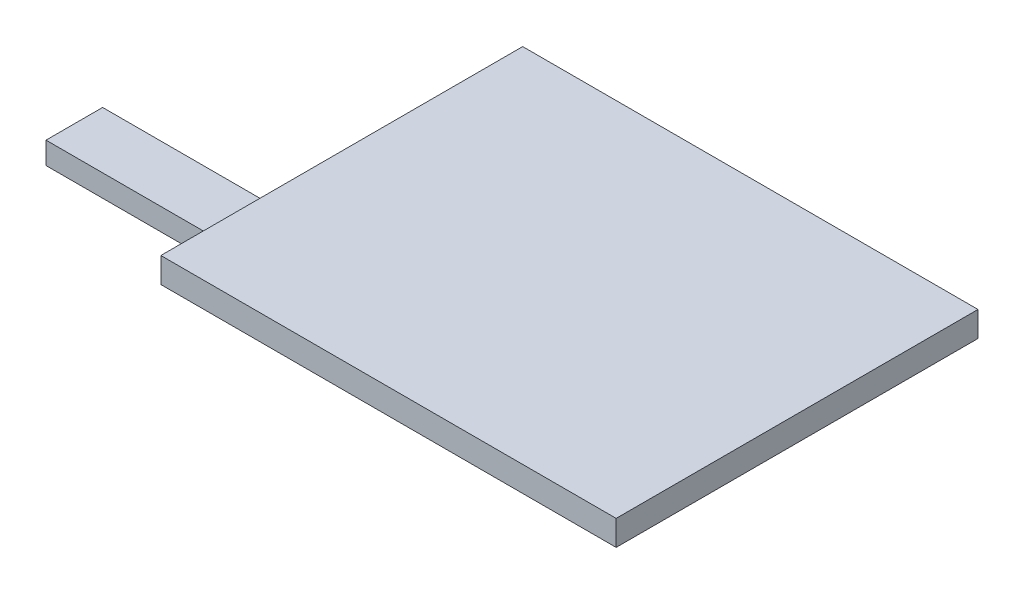
from build123d import *

# Parameters (mm, degrees)
SKETCH1_W           = 144.7
SKETCH1_H           = 8
BOSS_EXTRUDE1_DEPTH = 115
SKETCH3_W           = 10
SKETCH3_H           = 18
BOSS_EXTRUDE2_DEPTH = 14
SKETCH4_W           = 18
SKETCH4_H           = 7
BOSS_EXTRUDE6_DEPTH = 65
BOSS_EXTRUDE7_DEPTH = 10
BOSS_EXTRUDE8_DEPTH = 10


with BuildPart() as part:
    # Sketch1 → Boss-Extrude1 (new body)
    with BuildSketch(Plane.XY):
        with Locations((34.899775573, 7.072761635)):
            Rectangle(SKETCH1_W, SKETCH1_H)
    extrude(amount=BOSS_EXTRUDE1_DEPTH)

    # Sketch3 → Boss-Extrude2 (add)
    with BuildSketch(Plane.XZ.offset(-3.072761635)):
        with Locations((-32.450224427, 77.5)):
            Rectangle(SKETCH3_W, SKETCH3_H)
    extrude(amount=BOSS_EXTRUDE2_DEPTH)

    # Sketch4 → Boss-Extrude6 (add)
    with BuildSketch(Plane.ZY.offset(37.450224427)):
        with Locations((77.5, -7.427238365)):
            Rectangle(SKETCH4_W, SKETCH4_H)
    extrude(amount=BOSS_EXTRUDE6_DEPTH)

    # Sketch5 → Boss-Extrude7 (add)
    with BuildSketch(Plane.XY.offset(86.5)):
        Polygon((-37.450224427, 3.072761635), (-27.450224427, 3.072761635), (-27.450224427, -3.927238365), (-27.450224427, -10.927238365), (-37.450224427, -10.927238365), (-37.450224427, -3.927238365), align=None)
    extrude(amount=BOSS_EXTRUDE7_DEPTH)

    # Sketch6 → Boss-Extrude8 (add)
    with BuildSketch(Plane(origin=(0, 0, 68.5), x_dir=(-1, 0, 0), z_dir=(0, 0, -1))):
        Polygon((37.450224427, 3.072761635), (27.450224427, 3.072761635), (27.450224427, -3.927238365), (27.450224427, -10.927238365), (37.450224427, -10.927238365), (37.450224427, -3.927238365), align=None)
    extrude(amount=BOSS_EXTRUDE8_DEPTH)


solid = part.part
